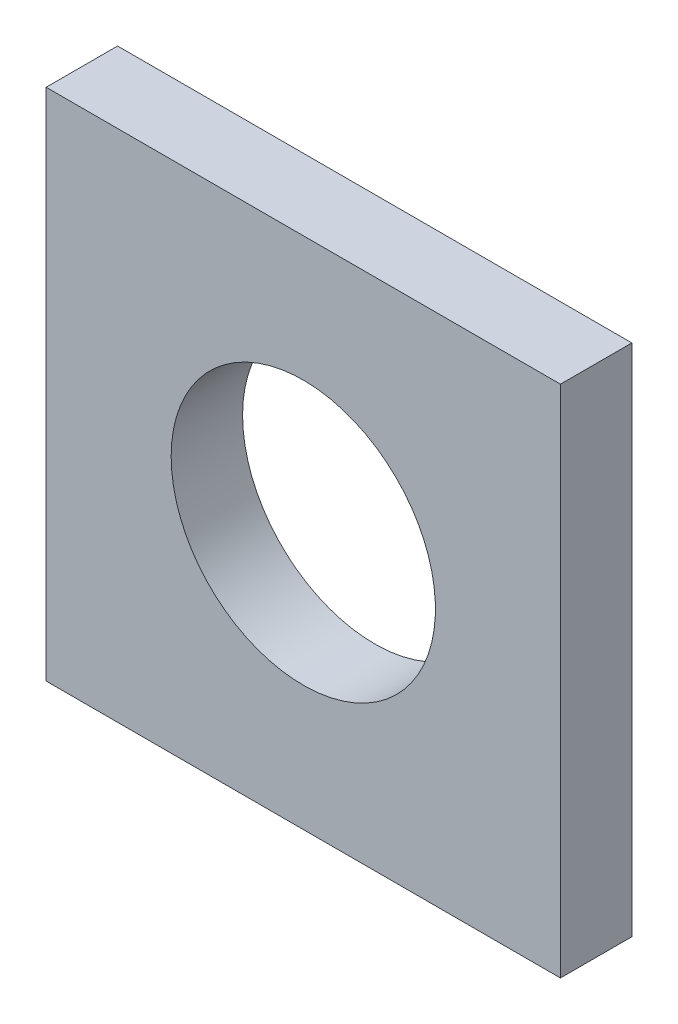
from build123d import *

# Parameters (mm, degrees)
SKETCH_1_W          = 36
SKETCH_1_H          = 36
SKETCH_1_R          = 2.25
EXTRUDE_1_DEPTH     = 3
SKETCH_2_W          = 36
SKETCH_2_H          = 36
EXTRUDE_2_DEPTH     = 2
SKETCH_4_R          = 9.25
CUT_EXTRUDE_1_DEPTH = 50.492465658


with BuildPart() as part:
    # 스케치1 → 보스-돌출1 (new body)
    with BuildSketch(Plane.XY):
        with Locations((17.845923561, -15.757575758)):
            Rectangle(SKETCH_1_W, SKETCH_1_H)
        with Locations((2.595923561, -0.507575758)):
            Circle(SKETCH_1_R, mode=Mode.SUBTRACT)
        with Locations((17.845923561, -0.507575758)):
            Circle(SKETCH_1_R, mode=Mode.SUBTRACT)
        with Locations((33.095923561, -0.507575758)):
            Circle(SKETCH_1_R, mode=Mode.SUBTRACT)
        with Locations((33.095923561, -15.757575758)):
            Circle(SKETCH_1_R, mode=Mode.SUBTRACT)
        with Locations((33.095923561, -31.007575758)):
            Circle(SKETCH_1_R, mode=Mode.SUBTRACT)
        with Locations((17.845923561, -31.007575758)):
            Circle(SKETCH_1_R, mode=Mode.SUBTRACT)
        with Locations((2.595923561, -31.007575758)):
            Circle(SKETCH_1_R, mode=Mode.SUBTRACT)
        with Locations((2.595923561, -15.757575758)):
            Circle(SKETCH_1_R, mode=Mode.SUBTRACT)
    extrude(amount=EXTRUDE_1_DEPTH)

    # 스케치2 → 보스-돌출2 (add)
    with BuildSketch(Plane.XY.offset(3)):
        with Locations((17.845923561, -15.757575758)):
            Rectangle(SKETCH_2_W, SKETCH_2_H)
    extrude(amount=EXTRUDE_2_DEPTH)

    # 스케치4 → 컷-돌출1 (cut, through all)
    with BuildSketch(Plane(origin=(0, 0, 0), x_dir=(-1, 0, 0), z_dir=(0, 0, -1))):
        with Locations((-17.845923561, -15.757575758)):
            Circle(SKETCH_4_R)
    extrude(amount=-CUT_EXTRUDE_1_DEPTH, mode=Mode.SUBTRACT)


solid = part.part
